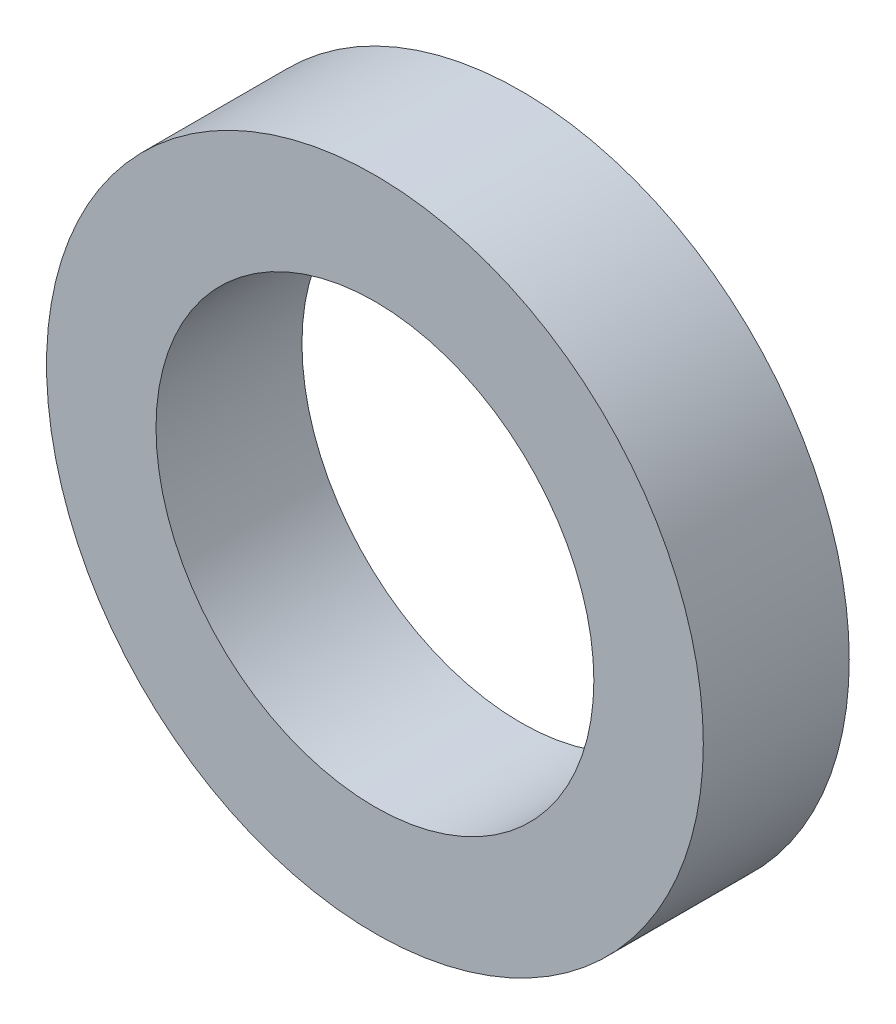
from build123d import *

# Parameters (mm, degrees)
SKETCH1_R           = 9
BOSS_EXTRUDE1_DEPTH = 4
SKETCH2_R           = 6
CUT_EXTRUDE1_DEPTH  = 14.341664064


with BuildPart() as part:
    # Sketch1 → Boss-Extrude1 (new body)
    with BuildSketch(Plane.XY):
        Circle(SKETCH1_R)
    extrude(amount=BOSS_EXTRUDE1_DEPTH)

    # Sketch2 → Cut-Extrude1 (cut, through all)
    with BuildSketch(Plane.XY.offset(4)):
        Circle(SKETCH2_R)
    extrude(amount=-CUT_EXTRUDE1_DEPTH, mode=Mode.SUBTRACT)


solid = part.part
